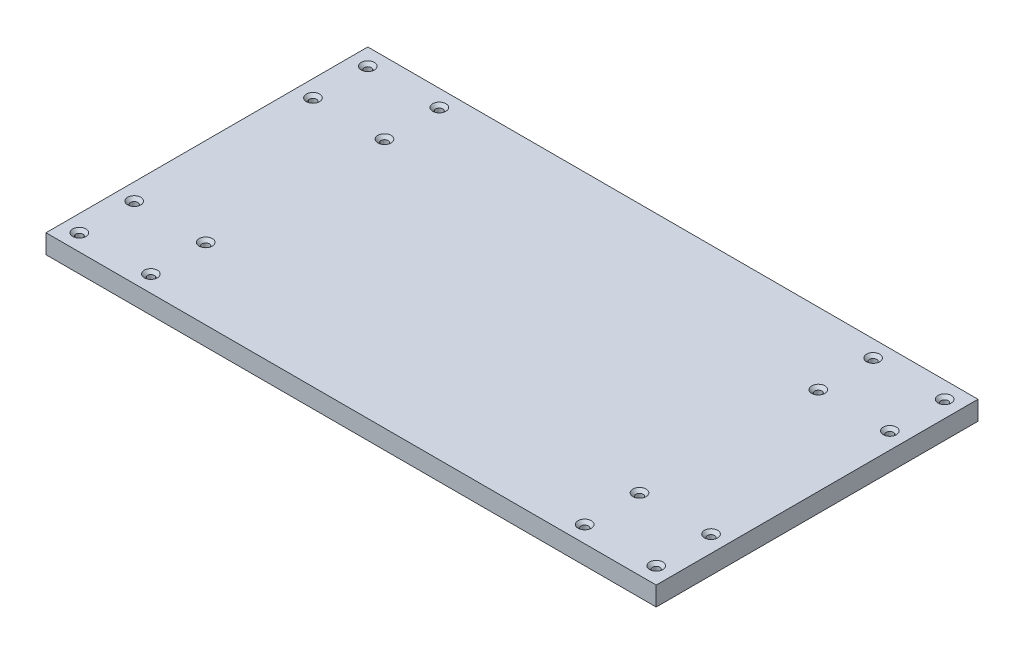
from build123d import *

# Parameters (mm, degrees)
SKETCH1_W                                       = 203.2
SKETCH1_H                                       = 107.15625
BOSS_EXTRUDE1_DEPTH                             = 6.35
CSK_FOR_M2_FLAT_HEAD_MACHINE_SCREW1_D           = 2.4
CSK_FOR_M2_FLAT_HEAD_MACHINE_SCREW1_CSINK_D     = 4.4
CSK_FOR_M2_FLAT_HEAD_MACHINE_SCREW1_CSINK_ANGLE = 90


with BuildPart() as part:
    # Sketch1 → Boss-Extrude1 (new body)
    with BuildSketch(Plane(origin=(0, 0, 0), x_dir=(1, 0, 0), z_dir=(0, 1, 0))):
        with Locations((101.6, 53.578125)):
            Rectangle(SKETCH1_W, SKETCH1_H)
    extrude(amount=BOSS_EXTRUDE1_DEPTH)

    # CSK for M2 Flat Head Machine Screw1 (through all)
    with Locations(Plane(origin=(0, 6.35, 0), x_dir=(1, 0, 0), z_dir=(0, 1, 0))):
        with Locations((5.55625, 101.6), (1.201469153, 116.400099152), (1.201469153, 113.370035287), (29.36875, 101.6), (5.55625, 5.55625), (29.36875, 5.55625), (173.83125, 5.55625), (173.83125, 101.6), (197.64375, 101.6), (197.64375, 5.55625), (5.55625, 83.34375), (29.36875, 83.34375), (5.55625, 23.8125), (173.83125, 83.34375), (197.64375, 83.34375), (173.83125, 23.8125), (197.64375, 23.8125), (29.36875, 23.8125)):
            CounterSinkHole(CSK_FOR_M2_FLAT_HEAD_MACHINE_SCREW1_D / 2, CSK_FOR_M2_FLAT_HEAD_MACHINE_SCREW1_CSINK_D / 2, counter_sink_angle=CSK_FOR_M2_FLAT_HEAD_MACHINE_SCREW1_CSINK_ANGLE)


solid = part.part
